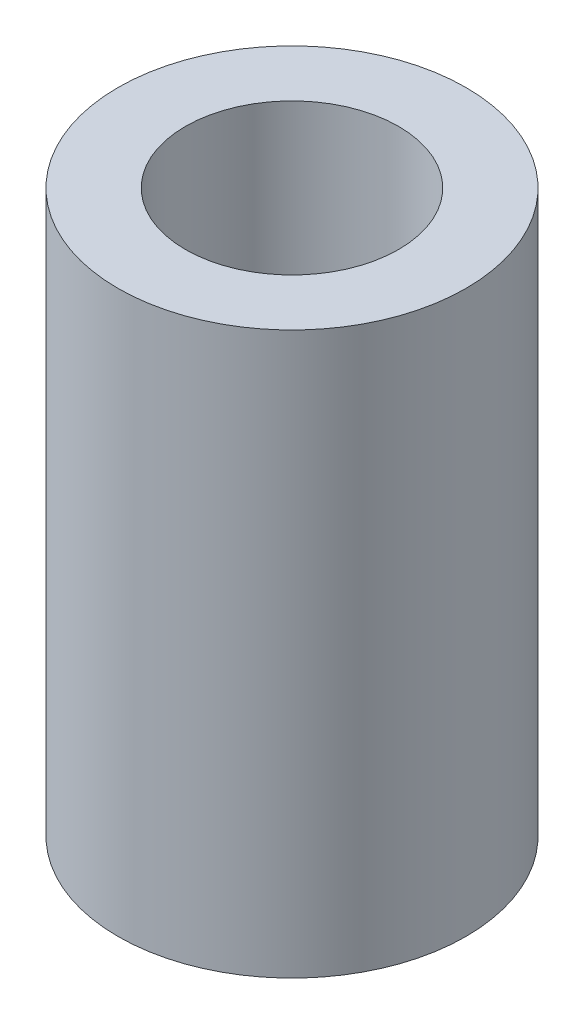
from build123d import *

# Parameters (mm, degrees)
CROQUIS1_R              = 7.75
SALIENTE_EXTRUIR1_DEPTH = 25
VACIADO1_T              = -3
CROQUIS4_R              = 7.75
SALIENTE_EXTRUIR2_DEPTH = 8.7
CORTAR_EXTRUIR1_DEPTH   = 36.6
CROQUIS2_R              = 2.3
CORTAR_EXTRUIR2_DEPTH   = 8.5


with BuildPart() as part:
    # Croquis1 → Saliente-Extruir1 (new body)
    with BuildSketch(Plane(origin=(0, 0, 0), x_dir=(1, 0, 0), z_dir=(0, 1, 0))):
        with Locations(Location((0, 0, 0), (0, 0, 270))):
            Circle(CROQUIS1_R)
    extrude(amount=SALIENTE_EXTRUIR1_DEPTH)

    # Vaciado1
    vaciado1_openings = [part.faces().sort_by_distance(p)[0] for p in [
        (0, 25, 0),
    ]]
    offset(amount=VACIADO1_T, openings=vaciado1_openings, kind=Kind.INTERSECTION)

    # Croquis4 → Saliente-Extruir2 (add)
    with BuildSketch(Plane.XZ):
        with Locations(Location((0, 0, 0), (0, 0, 90))):
            Circle(CROQUIS4_R)
    extrude(amount=-SALIENTE_EXTRUIR2_DEPTH)

    # Croquis3 → Cortar-Extruir1 (cut)
    with BuildSketch(Plane.XZ):
        with BuildLine():
            ThreePointArc((1.55, 0), (0.574750216, 1.439500674), (-1.123757664, 1.067552674))
            Line((-1.123757664, 1.067552674), (-1.123757664, -1.067552674))
            ThreePointArc((-1.123757664, -1.067552674), (0.574750216, -1.439500674), (1.55, 0))
        make_face()
    extrude(amount=-CORTAR_EXTRUIR1_DEPTH, mode=Mode.SUBTRACT)

    # Croquis2 → Cortar-Extruir2 (cut)
    with BuildSketch(Plane(origin=(0, 0, 0), x_dir=(0, 0, -1), z_dir=(1, 0, 0))):
        with Locations((0, 4.19773403)):
            Circle(CROQUIS2_R)
    extrude(amount=-CORTAR_EXTRUIR2_DEPTH, mode=Mode.SUBTRACT)


solid = part.part
